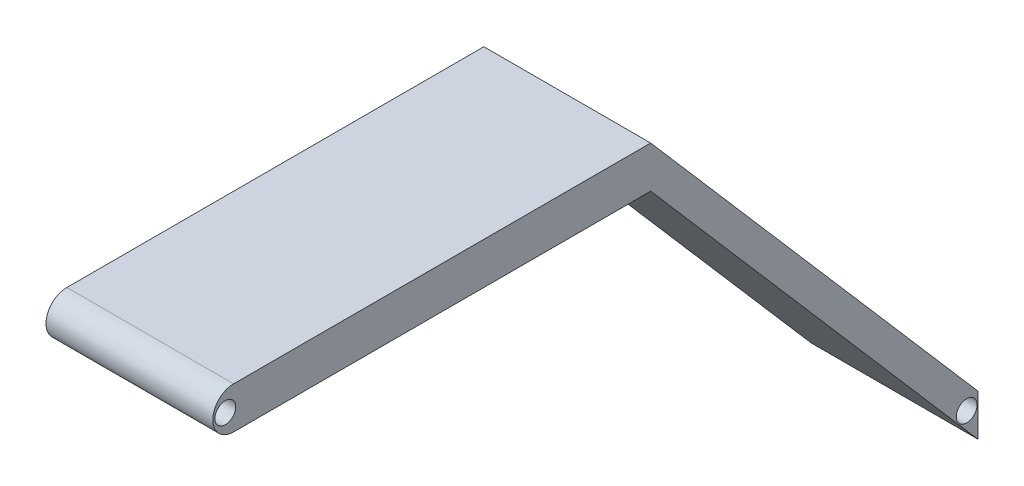
from build123d import *

# Parameters (mm, degrees)
SKETCH_1_W          = 10
SKETCH_1_H          = 1
EXTRUDE_1_DEPTH     = 4
EXTRUDE_2_DEPTH     = 4
EXTRUDE_4_DEPTH     = 4
SKETCH_8_R          = 0.25
CUT_EXTRUDE_1_DEPTH = 10
SKETCH_9_R          = 0.25
CUT_EXTRUDE_2_DEPTH = 10
SCALE_1_SCALE       = 2.454545455


with BuildPart() as part:
    # 草图1 → 凸台-拉伸1 (new body)
    with BuildSketch(Plane(origin=(0, 0, 0), x_dir=(0, 0, -1), z_dir=(1, 0, 0))):
        with Locations((-6.174242424, 5.174378087)):
            Rectangle(SKETCH_1_W, SKETCH_1_H)
    extrude(amount=EXTRUDE_1_DEPTH)

    # 草图4 → 凸台-拉伸2 (add)
    with BuildSketch(Plane(origin=(4, 0, 0), x_dir=(0, 0, -1), z_dir=(1, 0, 0))):
        Polygon((-1.174242424, 5.674378087), (-1.174242424, 4.674378087), (6.675052733, -4.402436637), (6.675052733, -3.402436637), align=None)
    extrude(amount=-EXTRUDE_2_DEPTH)

    # 草图7 → 凸台-拉伸4 (add)
    with BuildSketch(Plane(origin=(4, 0, 0), x_dir=(0, 0, -1), z_dir=(1, 0, 0))):
        with BuildLine():
            Line((-11.174242424, 5.674378087), (-11.174242424, 4.674378087))
            ThreePointArc((-11.174242424, 4.674378087), (-11.674242424, 5.174378087), (-11.174242424, 5.674378087))
        make_face()
    extrude(amount=-EXTRUDE_4_DEPTH)

    # 草图8 → 切除-拉伸1 (cut)
    with BuildSketch(Plane(origin=(4, 0, 0), x_dir=(0, 0, -1), z_dir=(1, 0, 0))):
        with Locations((-11.374242424, 5.174378087)):
            Circle(SKETCH_8_R)
    extrude(amount=-CUT_EXTRUDE_1_DEPTH, mode=Mode.SUBTRACT)

    # 草图9 → 切除-拉伸2 (cut)
    with BuildSketch(Plane(origin=(4, 0, 0), x_dir=(0, 0, -1), z_dir=(1, 0, 0))):
        with Locations((6.403659304, -3.675825169)):
            Circle(SKETCH_9_R)
    extrude(amount=-CUT_EXTRUDE_2_DEPTH, mode=Mode.SUBTRACT)


with BuildPart() as part_1:
    # 缩放比例1: scaled about (2, 3.275952111, 2.445427585)
    add(part.part.scale(SCALE_1_SCALE).moved(Location((-2.909090909, -4.765021252, -3.556985578))))


solid = part_1.part
